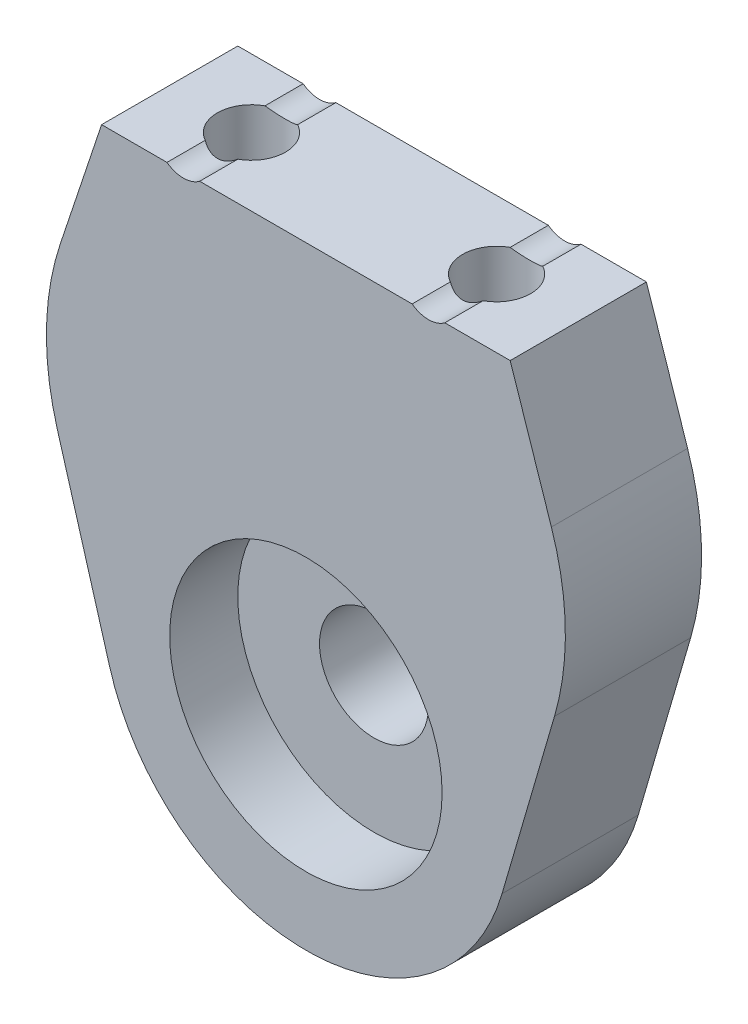
from build123d import *

# Parameters (mm, degrees)
SKETCH_1_R             = 7.5
SKETCH_1_R_2           = 2
EXTRUDE_1_DEPTH        = 5
EXTRUDE_START          = -5
EXTRUDE_2_DEPTH        = 5
SKETCH_3_R             = 1
CUT_EXTRUDE_1_DEPTH    = 5
EXTRUDE_3_DEPTH        = 5
FILLET_1_R             = 10
SKETCH_11_R            = 5
CUT_EXTRUDE_4_DEPTH    = 2.5
SKETCH_12_R            = 1
CUT_EXTRUDE_5_DEPTH    = 19.45893317
HOLE_WIZARD_M3_1_D     = 2.5
HOLE_WIZARD_M3_1_DEPTH = 8.5
HOLE_WIZARD_M3_1_TIP   = 0.751075774


with BuildPart() as part:
    # ｽｹｯﾁ1 → ﾎﾞｽ - 押し出し1 (new body)
    with BuildSketch(Plane.XY):
        Circle(SKETCH_1_R)
        Circle(SKETCH_1_R_2, mode=Mode.SUBTRACT)
    extrude(amount=EXTRUDE_1_DEPTH)

    # ｽｹｯﾁ2 → ﾎﾞｽ - 押し出し2 (add)
    with BuildSketch(Plane.XY.offset(5).offset(EXTRUDE_START)):
        with BuildLine():
            Line((-7.5, 0), (-7.5, 15))
            Line((-7.5, 15), (7.5, 15))
            Line((7.5, 15), (7.5, 0))
            ThreePointArc((7.5, 0), (0, 7.5), (-7.5, 0))
        make_face()
    extrude(amount=EXTRUDE_2_DEPTH)

    # ｽｹｯﾁ3 → ｶｯﾄ - 押し出し1 (cut)
    with BuildSketch(Plane(origin=(0, 15, 0), x_dir=(1, 0, 0), z_dir=(0, 1, 0))):
        with Locations(Location((-4.5, -2.5, 0), (0, 0, 270))):
            Circle(SKETCH_3_R)
        with Locations(Location((4.5, -2.5, 0), (0, 0, 90))):
            Circle(SKETCH_3_R)
    extrude(amount=-CUT_EXTRUDE_1_DEPTH, mode=Mode.SUBTRACT)

    # ｽｹｯﾁ4 → ﾎﾞｽ - 押し出し3 (add)
    with BuildSketch(Plane.XY.offset(5).offset(EXTRUDE_START)):
        with BuildLine():
            Line((-7.5, 15), (-10, 7.5))
            Line((-10, 7.5), (-7.2, -2.1))
            ThreePointArc((-7.2, -2.1), (-7.424621202, -1.060660172), (-7.5, 0))
            Line((-7.5, 0), (-7.5, 15))
        make_face()
        with BuildLine():
            Line((7.5, 0), (7.5, 15))
            Line((7.5, 15), (10, 7.5))
            Line((10, 7.5), (7.2, -2.1))
            ThreePointArc((7.2, -2.1), (7.424621202, -1.060660172), (7.5, 0))
        make_face()
    extrude(amount=EXTRUDE_3_DEPTH)

    # ﾌｨﾚｯﾄ1
    fillet_1_edges = [part.edges().sort_by_distance(p)[0] for p in [
        (-10, 7.5, 2.5),
        (10, 7.5, 2.5),
    ]]
    fillet(fillet_1_edges, radius=FILLET_1_R)

    # ｽｹｯﾁ11 → ｶｯﾄ - 押し出し4 (cut)
    with BuildSketch(Plane.XY.offset(5)):
        Circle(SKETCH_11_R)
    extrude(amount=-CUT_EXTRUDE_4_DEPTH, mode=Mode.SUBTRACT)

    # ｽｹｯﾁ12 → ｶｯﾄ - 押し出し5 (cut, through all)
    with BuildSketch(Plane(origin=(0, 0, 0), x_dir=(-1, 0, 0), z_dir=(0, 0, -1))):
        with Locations((-4.5, 15.8)):
            Circle(SKETCH_12_R)
        with Locations((4.5, 15.8)):
            Circle(SKETCH_12_R)
    extrude(amount=-CUT_EXTRUDE_5_DEPTH, mode=Mode.SUBTRACT)

    # M3 ねじ穴1
    with Locations(Plane(origin=(0, 15, 0), x_dir=(1, 0, 0), z_dir=(0, 1, 0))):
        with Locations((-4.5, -2.5), (4.5, -2.5)):
            Hole(HOLE_WIZARD_M3_1_D / 2, depth=HOLE_WIZARD_M3_1_DEPTH)
            with Locations((0, 0, -(HOLE_WIZARD_M3_1_DEPTH + HOLE_WIZARD_M3_1_TIP / 2))):  # 118° drill point
                Cone(0, HOLE_WIZARD_M3_1_D / 2, HOLE_WIZARD_M3_1_TIP, mode=Mode.SUBTRACT)


solid = part.part
